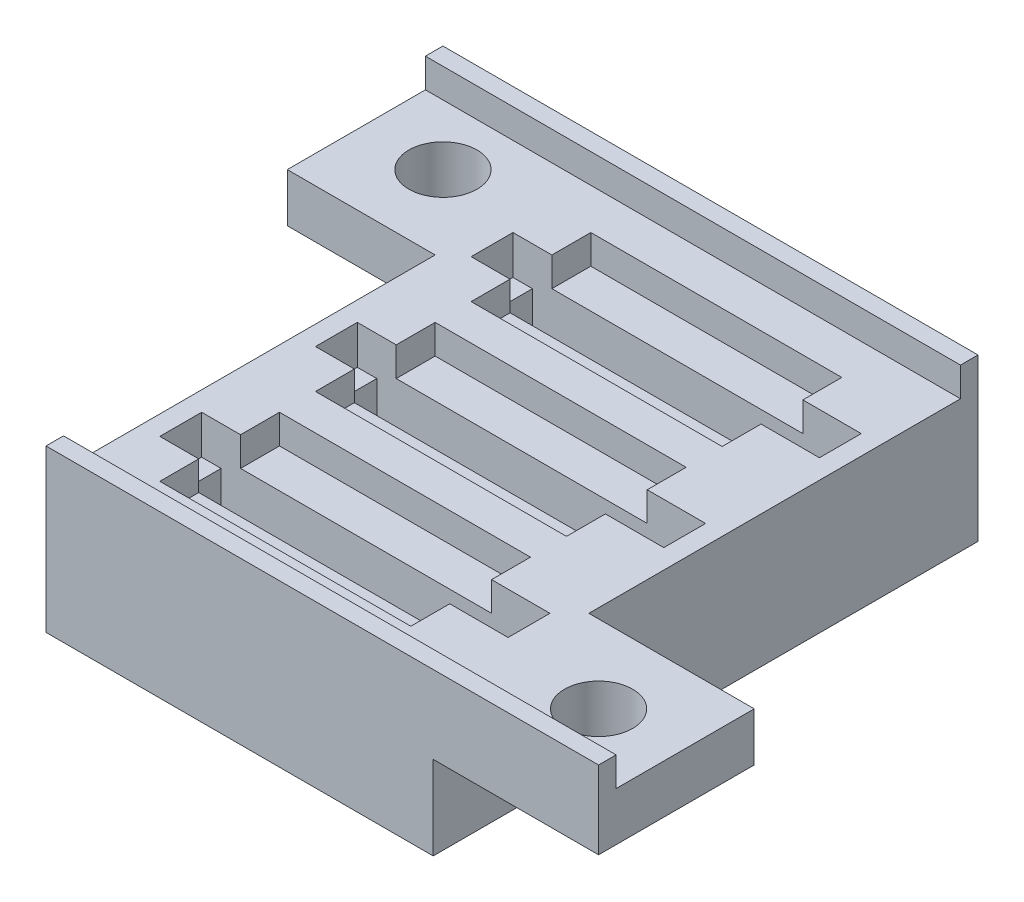
from build123d import *

# Parameters (mm, degrees)
SKETCH1_W           = 15.9
SKETCH1_H           = 2.15
SKETCH1_R           = 1.75
BASE_DEPTH          = 2.5
SKETCH3_W           = 17.9
SKETCH3_H           = 2.15
CUT_EXTRUDE1_DEPTH  = 2
SKETCH4_W           = 19.9
SKETCH4_H           = 28
SKETCH4_W_2         = 15.9
SKETCH4_H_2         = 2.15
BOSS_EXTRUDE1_DEPTH = 4.3
SKETCH5_W           = 12.9
SKETCH5_H           = 6.15
CUT_EXTRUDE2_DEPTH  = 1.5
SKETCH6_W           = 27.5
SKETCH6_H           = 0.9
BOSS_EXTRUDE2_DEPTH = 1.5
SKETCH6_3_W         = 27.5
SKETCH6_3_H         = 0.9
SKETCH6_3_W_2       = 28.4
BOSS_EXTRUDE3_DEPTH = 1.5


with BuildPart() as part:
    # Sketch1 → Base (new body)
    with BuildSketch(Plane(origin=(0, 0, 0), x_dir=(1, 0, 0), z_dir=(0, 1, 0))):
        Polygon((-9.6, 15.15), (-2, 15.15), (-2, -4.85), (26.4, -4.85), (26.4, 3.15), (17.9, 3.15), (17.9, 23.15), (-9.6, 23.15), align=None)
        with Locations((7.95, 1.075)):
            Rectangle(SKETCH1_W, SKETCH1_H, mode=Mode.SUBTRACT)
        with Locations((7.95, 9.075)):
            Rectangle(SKETCH1_W, SKETCH1_H, mode=Mode.SUBTRACT)
        with Locations((22.4, -0.85)):
            Circle(SKETCH1_R, mode=Mode.SUBTRACT)
        with Locations((-5.6, 19.15)):
            Circle(SKETCH1_R, mode=Mode.SUBTRACT)
        with Locations((7.95, 17.075)):
            Rectangle(SKETCH1_W, SKETCH1_H, mode=Mode.SUBTRACT)
    extrude(amount=BASE_DEPTH)

    # Sketch3 → Cut-Extrude1 (cut)
    with BuildSketch(Plane(origin=(0, 2.5, 0), x_dir=(1, 0, 0), z_dir=(0, 1, 0))):
        with Locations((7.95, 17.075)):
            Rectangle(SKETCH3_W, SKETCH3_H)
        with Locations((7.95, 9.075)):
            Rectangle(SKETCH3_W, SKETCH3_H)
        with Locations((7.95, 1.075)):
            Rectangle(SKETCH3_W, SKETCH3_H)
    extrude(amount=-CUT_EXTRUDE1_DEPTH, mode=Mode.SUBTRACT)

    # Sketch4 → Boss-Extrude1 (add)
    with BuildSketch(Plane.XZ):
        with Locations((7.95, -9.15)):
            Rectangle(SKETCH4_W, SKETCH4_H)
        with Locations((7.95, -17.075)):
            Rectangle(SKETCH4_W_2, SKETCH4_H_2, mode=Mode.SUBTRACT)
        with Locations((7.95, -9.075)):
            Rectangle(SKETCH4_W_2, SKETCH4_H_2, mode=Mode.SUBTRACT)
        with Locations((7.95, -1.075)):
            Rectangle(SKETCH4_W_2, SKETCH4_H_2, mode=Mode.SUBTRACT)
    extrude(amount=BOSS_EXTRUDE1_DEPTH)

    # Sketch5 → Cut-Extrude2 (cut)
    with BuildSketch(Plane(origin=(0, 2.5, 0), x_dir=(1, 0, 0), z_dir=(0, 1, 0))):
        with Locations((7.45, 17.075)):
            Rectangle(SKETCH5_W, SKETCH5_H)
        with Locations((7.45, 9.075)):
            Rectangle(SKETCH5_W, SKETCH5_H)
        with Locations((7.45, 1.075)):
            Rectangle(SKETCH5_W, SKETCH5_H)
    extrude(amount=-CUT_EXTRUDE2_DEPTH, mode=Mode.SUBTRACT)

    # Sketch6 → Boss-Extrude2 (add)
    with BuildSketch(Plane(origin=(0, 2.5, 0), x_dir=(1, 0, 0), z_dir=(0, 1, 0))):
        with Locations((4.15, 22.7)):
            Rectangle(SKETCH6_W, SKETCH6_H)
    extrude(amount=BOSS_EXTRUDE2_DEPTH)

    # Sketch6<3> → Boss-Extrude3 (add)
    with BuildSketch(Plane(origin=(0, 2.5, 0), x_dir=(1, 0, 0), z_dir=(0, 1, 0))):
        with Locations((4.15, 22.7)):
            Rectangle(SKETCH6_3_W, SKETCH6_3_H)
        with Locations((12.2, -4.4)):
            Rectangle(SKETCH6_3_W_2, SKETCH6_3_H)
    extrude(amount=BOSS_EXTRUDE3_DEPTH)


solid = part.part
